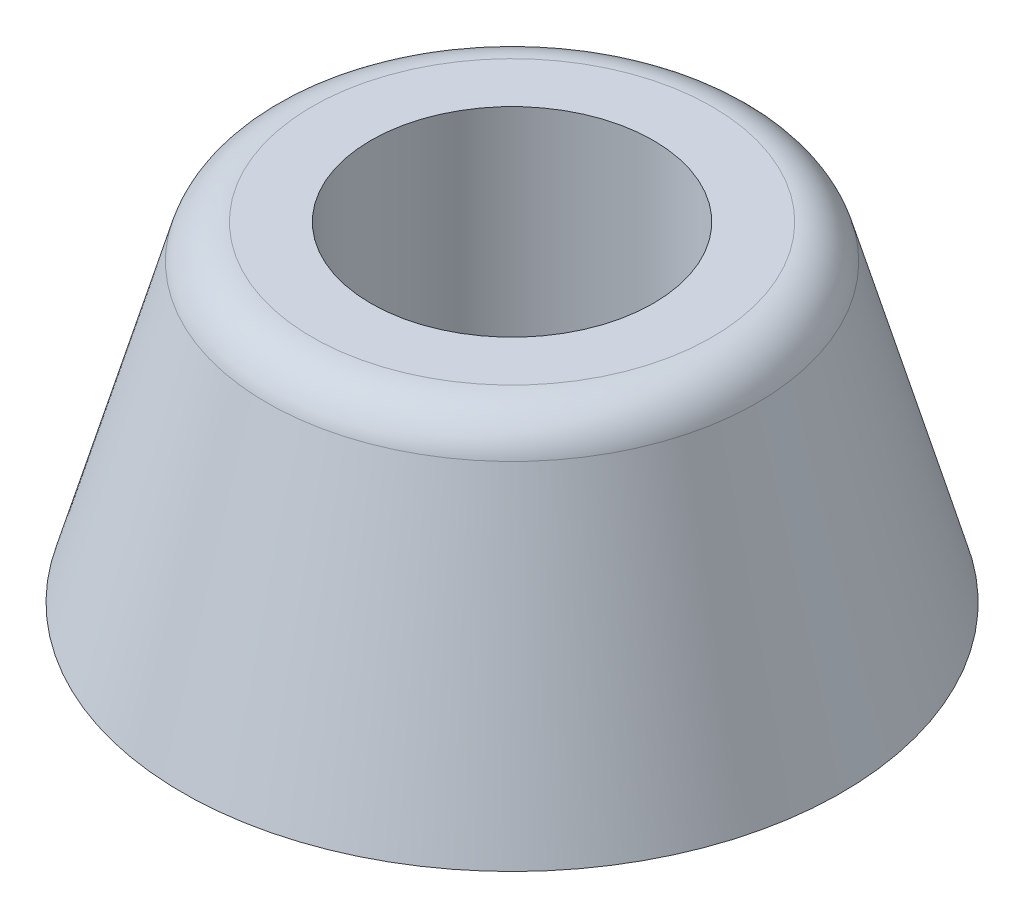
from build123d import *


with BuildPart() as part:
    # Croquis1 → Revolución1 (revolve)
    with BuildSketch(Plane.XY, mode=Mode.PRIVATE) as revoluci_n1_sk:
        with BuildLine():
            Line((-7, 0), (-1.5, 0))
            Line((-1.5, 0), (-1.5, 2))
            Line((-1.5, 2), (-3, 2))
            Line((-3, 2), (-3, 7))
            Line((-3, 7), (-4.245698587, 7))
            ThreePointArc((-4.245698587, 7), (-4.8478941, 6.798348648), (-5.207222535, 6.274721128))
            Line((-5.207222535, 6.274721128), (-7, 0))
        make_face()
    revolve(revoluci_n1_sk.sketch.rotate(Axis((0, 0, 0), (0, 1, 0)), 270), axis=Axis((0, 0, 0), (0, 1, 0)))


solid = part.part
